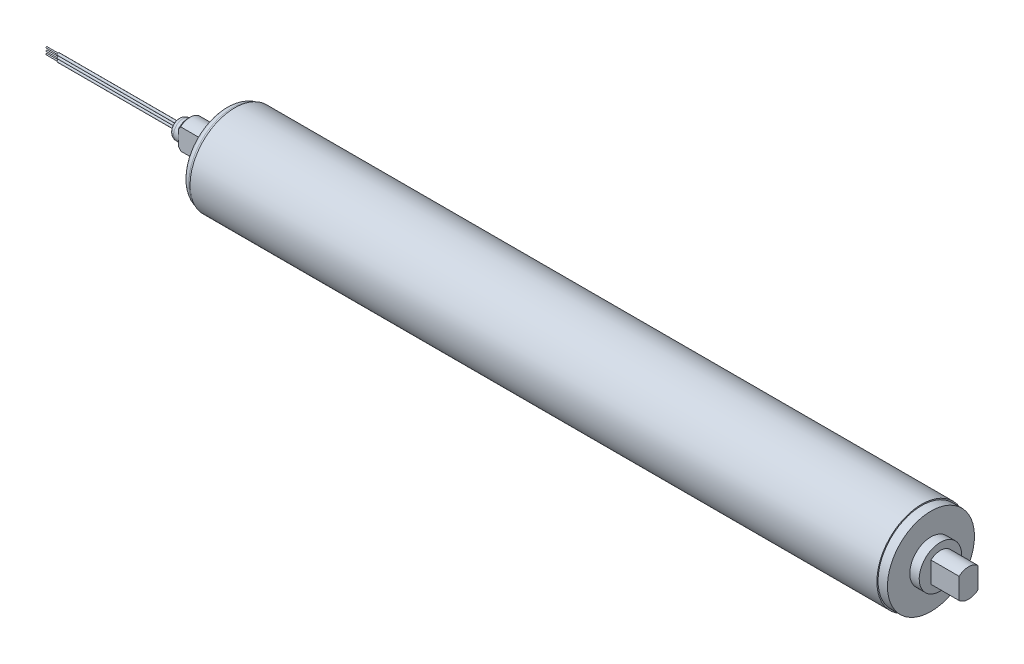
from build123d import *

# Parameters (mm, degrees)
CUT_EXTRUDE1_DEPTH = 326.112288294
CUT_EXTRUDE2_DEPTH = 322.126143439
LPATTERN1_COUNT    = 3
LPATTERN1_PITCH    = 1.25


with BuildPart() as part:
    # Sketch2 → Revolve2 (revolve)
    with BuildSketch(Plane.XY, mode=Mode.PRIVATE) as revolve2_sk:
        with BuildLine():
            Line((-4, 18.5), (0, 18.5))
            Line((0, 18.5), (0, 9))
            Line((0, 9), (4, 9))
            Line((4, 9), (4, 6))
            Line((4, 6), (16, 6))
            Line((16, 6), (16, 0))
            Line((16, 0), (-320, 0))
            Line((-320, 0), (-320, 2))
            ThreePointArc((-320, 2), (-319.414213562, 3.414213562), (-318, 4))
            Line((-318, 4), (-316, 4))
            Line((-316, 4), (-316, 5))
            Line((-316, 5), (-315, 6))
            Line((-315, 6), (-304, 6))
            Line((-304, 6), (-304, 8.2))
            Line((-304, 8.2), (-303.2, 9))
            Line((-303.2, 9), (-300, 9))
            Line((-300, 9), (-300, 15.5))
            ThreePointArc((-300, 15.5), (-299.121320344, 17.621320344), (-297, 18.5))
            Line((-297, 18.5), (-296, 18.5))
            Line((-296, 18.5), (-296, 19))
            Line((-296, 19), (-4, 19))
            Line((-4, 19), (-4, 18.5))
        make_face()
    revolve(revolve2_sk.sketch.rotate(Axis((-320, 0, 0), (1, 0, 0)), 180), axis=Axis((-320, 0, 0), (1, 0, 0)))

    # Sketch3 → Cut-Extrude1 (cut, through all)
    with BuildSketch(Plane(origin=(4, 0, 0), x_dir=(0, 0, -1), z_dir=(1, 0, 0))):
        with BuildLine():
            Line((-4, 4.472135955), (-4, -4.472135955))
            ThreePointArc((-4, -4.472135955), (-6, 0), (-4, 4.472135955))
        make_face()
        with BuildLine():
            Line((4, 4.472135955), (4, -4.472135955))
            ThreePointArc((4, -4.472135955), (6, 0), (4, 4.472135955))
        make_face()
    extrude(amount=CUT_EXTRUDE1_DEPTH, mode=Mode.SUBTRACT)

    # Sketch4 → Cut-Extrude2 (cut, through all)
    with BuildSketch(Plane(origin=(-304, 0, 0), x_dir=(0, 0, -1), z_dir=(1, 0, 0))):
        with BuildLine():
            Line((-4, 4.472135955), (-4, -4.472135955))
            ThreePointArc((-4, -4.472135955), (-6, 0), (-4, 4.472135955))
        make_face()
        with BuildLine():
            Line((4, 4.472135955), (4, -4.472135955))
            ThreePointArc((4, -4.472135955), (6, 0), (4, 4.472135955))
        make_face()
    extrude(amount=-CUT_EXTRUDE2_DEPTH, mode=Mode.SUBTRACT)

    # Sketch8 → Revolve3 (revolve)
    with BuildSketch(Plane.XY, mode=Mode.PRIVATE) as revolve3_sk:
        Polygon((-316, 1.75), (-371, 1.75), (-371, 1.5), (-376, 1.5), (-376, 1.25), (-316, 1.25), align=None)
    revolve3 = revolve(revolve3_sk.sketch.rotate(Axis((-377.615440864, 1.25, 0), (1, 0, 0)), 90), axis=Axis((-377.615440864, 1.25, 0), (1, 0, 0)))

    # LPattern1: Revolve3 ×3
    with Locations(*[(0, -i * LPATTERN1_PITCH, 0) for i in range(1, LPATTERN1_COUNT)]):
        add(revolve3)


solid = part.part
